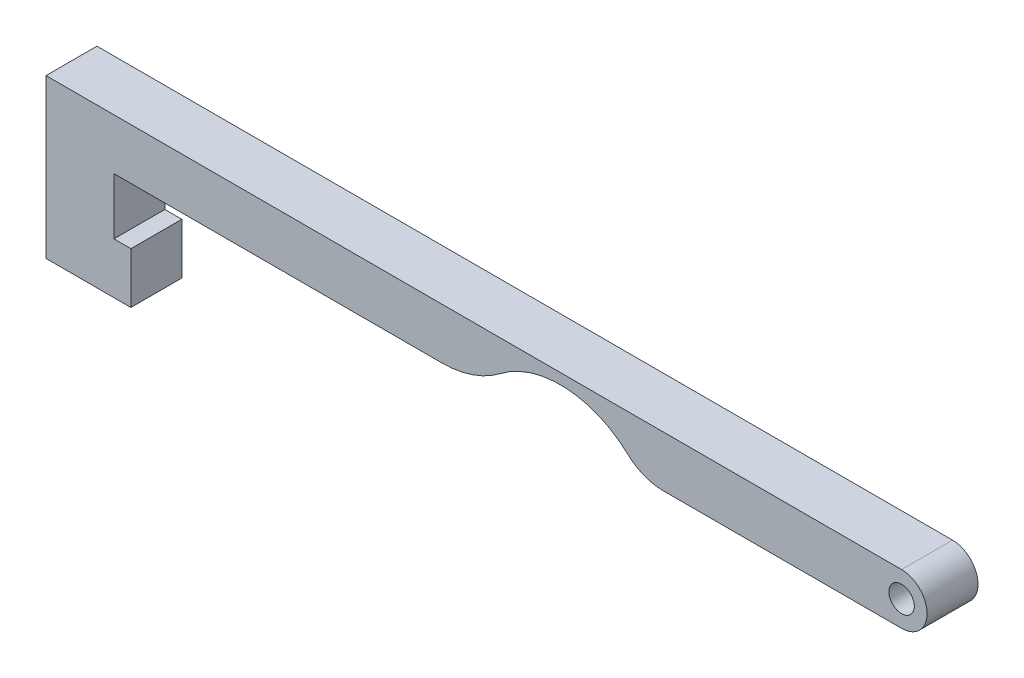
from build123d import *

# Parameters (mm, degrees)
SKETCH1_R           = 7.5
BOSS_EXTRUDE1_DEPTH = 30


with BuildPart() as part:
    # Sketch1 → Boss-Extrude1 (new body)
    with BuildSketch(Plane.XY):
        with BuildLine():
            Line((50, 0), (0, 0))
            Line((0, 0), (0, 93.284928504))
            Line((0, 93.284928504), (503.852842171, 93.284928504))
            ThreePointArc((503.852842171, 93.284928504), (518.852842171, 78.284928504), (503.852842171, 63.284928504))
            Line((503.852842171, 63.284928504), (363.350187842, 63.284928504))
            ThreePointArc((363.350187842, 63.284928504), (352.240737336, 65.393651705), (342.676664352, 71.426487861))
            ThreePointArc((342.676664352, 71.426487861), (305.687057236, 87.010211012), (267.394723934, 74.977726972))
            ThreePointArc((267.394723934, 74.977726972), (251.183228702, 66.288195069), (233.036577983, 63.284928504))
            Line((233.036577983, 63.284928504), (40, 63.284928504))
            Line((40, 63.284928504), (40, 30))
            Line((40, 30), (50, 30))
            Line((50, 30), (50, 0))
        make_face()
        with Locations((503.852842171, 78.284928504)):
            Circle(SKETCH1_R, mode=Mode.SUBTRACT)
    extrude(amount=BOSS_EXTRUDE1_DEPTH)


solid = part.part
